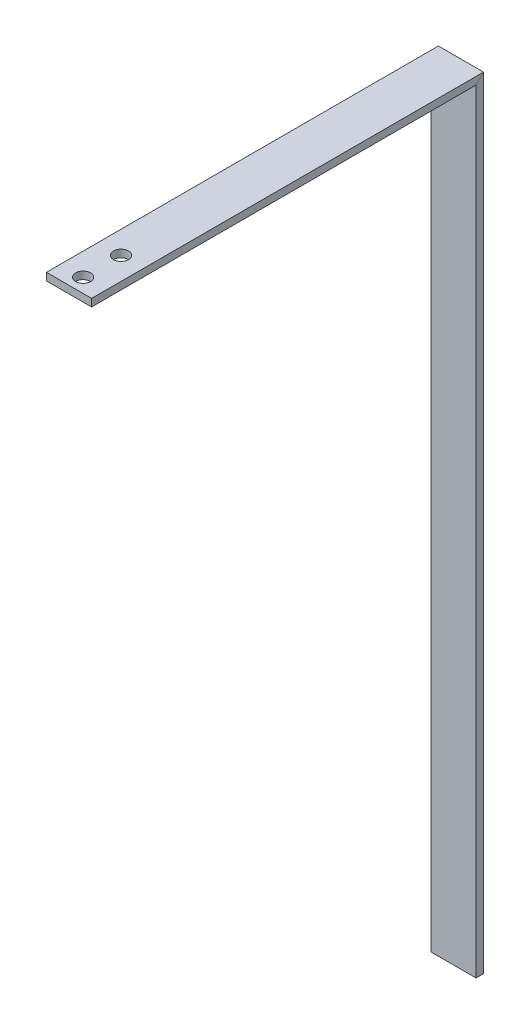
from build123d import *

# Parameters (mm, degrees)
CROQUIS1_W              = 38.1
CROQUIS1_H              = 850.5
SALIENTE_EXTRUIR1_DEPTH = 6.31
CROQUIS2_W              = 38.1
CROQUIS2_H              = 6.31
SALIENTE_EXTRUIR2_DEPTH = 70
CROQUIS3_W              = 38.1
CROQUIS3_H              = 6.31
SALIENTE_EXTRUIR3_DEPTH = 578
CROQUIS4_R              = 6.935856655
CORTAR_EXTRUIR1_DEPTH   = 7
CROQUIS5_W              = 38.1
CROQUIS5_H              = 687.72607772
CORTAR_EXTRUIR2_DEPTH   = 10
CROQUIS6_W              = 38.1
CROQUIS6_H              = 6.31
CROQUIS8_W              = 368.89
CROQUIS8_H              = 6.31
CORTAR_EXTRUIR3_DEPTH   = 147
CROQUIS9_R              = 6.35
CORTAR_EXTRUIR4_DEPTH   = 6.31


with BuildPart() as part:
    # Croquis1 → Saliente-Extruir1 (new body)
    with BuildSketch(Plane.XY):
        Rectangle(CROQUIS1_W, CROQUIS1_H)
    extrude(amount=SALIENTE_EXTRUIR1_DEPTH)

    # Croquis2 → Saliente-Extruir2 (add)
    with BuildSketch(Plane.XY.offset(6.31)):
        with Locations((0, -422.095)):
            Rectangle(CROQUIS2_W, CROQUIS2_H)
    extrude(amount=SALIENTE_EXTRUIR2_DEPTH)

    # Croquis3 → Saliente-Extruir3 (add)
    with BuildSketch(Plane.XY.offset(6.31)):
        with Locations((0, -265.63107772)):
            Rectangle(CROQUIS3_W, CROQUIS3_H)
    extrude(amount=-SALIENTE_EXTRUIR3_DEPTH)

    # Croquis4 → Cortar-Extruir1 (cut)
    with BuildSketch(Plane(origin=(0, -262.47607772, 0), x_dir=(1, 0, 0), z_dir=(0, 1, 0))):
        with Locations(Location((0, 536.981534281, 0), (0, 0, 270))):
            Circle(CROQUIS4_R)
    extrude(amount=-CORTAR_EXTRUIR1_DEPTH, mode=Mode.SUBTRACT)

    # Croquis5 → Cortar-Extruir2 (cut)
    with BuildSketch(Plane(origin=(0, 0, 0), x_dir=(-1, 0, 0), z_dir=(0, 0, -1))):
        with Locations((0, 81.38696114)):
            Rectangle(CROQUIS5_W, CROQUIS5_H)
    extrude(amount=-CORTAR_EXTRUIR2_DEPTH, mode=Mode.SUBTRACT)

    # Barrer1: sweep along a curve in space
    with BuildLine() as barrer1_path:
        Line((0, -262.47607772, -199.645), (0, 386.85392228, -199.645))
        Line((0, 386.85392228, -199.645), (0, 386.85392228, 127.905))
    # Croquis6 → Barrer1 (sweep)
    with BuildSketch(Plane(origin=(0, -262.47607772, 0), x_dir=(1, 0, 0), z_dir=(0, 1, 0))):
        with Locations((0, 199.645)):
            Rectangle(CROQUIS6_W, CROQUIS6_H)
    sweep(path=barrer1_path.line, transition=Transition.RIGHT)

    # Croquis8 → Cortar-Extruir3 (cut)
    with BuildSketch(Plane(origin=(19.05, 0, 0), x_dir=(0, 0, -1), z_dir=(1, 0, 0))):
        Polygon((196.49, -262.47607772), (196.49, -268.78607772), (196.49, -444.307673596), (-90.834600665, -444.307673596), (-90.834600665, -262.47607772), align=None)
        with Locations((387.245, -265.63107772)):
            Rectangle(CROQUIS8_W, CROQUIS8_H)
    extrude(amount=-CORTAR_EXTRUIR3_DEPTH, mode=Mode.SUBTRACT)

    # Croquis9 → Cortar-Extruir4 (cut)
    with BuildSketch(Plane(origin=(0, 390.00892228, 0), x_dir=(1, 0, 0), z_dir=(0, 1, 0))):
        with Locations(Location((0, -84.010000001, 0), (0, 0, 180))):
            Circle(CROQUIS9_R)
        with Locations(Location((0, -116.010000001, 0), (0, 0, 180))):
            Circle(CROQUIS9_R)
    extrude(amount=-CORTAR_EXTRUIR4_DEPTH, mode=Mode.SUBTRACT)


solid = part.part
